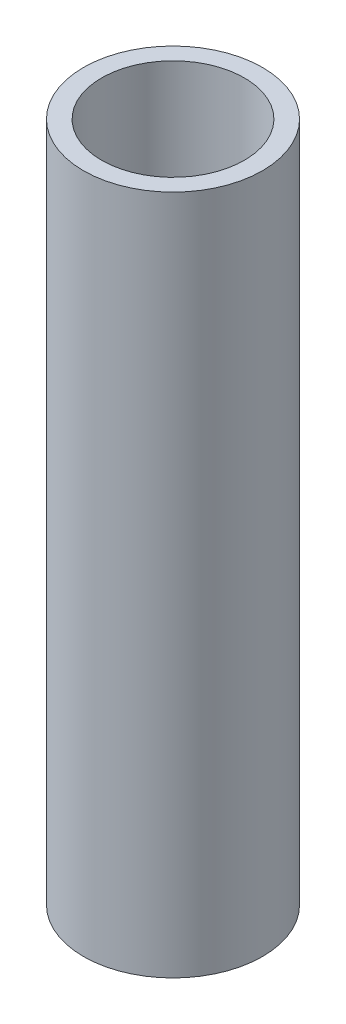
from build123d import *

# Parameters (mm, degrees)
SKETCH1_R           = 16.7005
SKETCH1_R_2         = 13.3223
BOSS_EXTRUDE1_DEPTH = 127


with BuildPart() as part:
    # Sketch1 → Boss-Extrude1 (new body)
    with BuildSketch(Plane(origin=(0, 0, 0), x_dir=(1, 0, 0), z_dir=(0, 1, 0))):
        with Locations(Location((0, 0, 0), (0, 0, 270))):
            Circle(SKETCH1_R)
        with Locations(Location((0, 0, 0), (0, 0, 270))):
            Circle(SKETCH1_R_2, mode=Mode.SUBTRACT)
    extrude(amount=BOSS_EXTRUDE1_DEPTH)


solid = part.part
